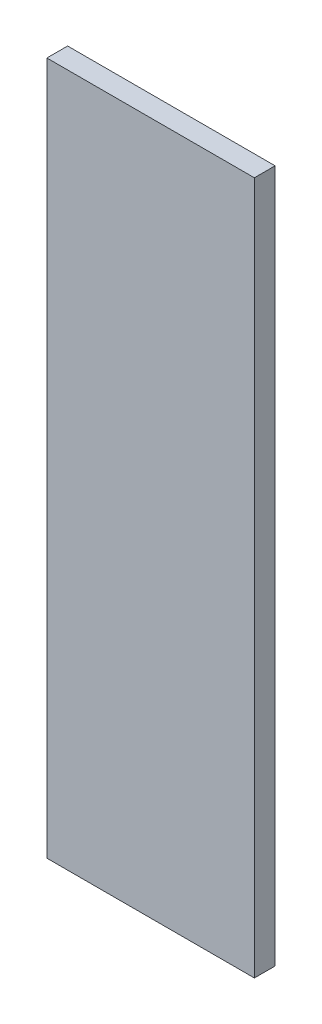
from build123d import *

# Parameters (mm, degrees)
ESQUISSE2_W        = 50
ESQUISSE2_H        = 167
BOSS_EXTRU_1_DEPTH = 5


with BuildPart() as part:
    # Esquisse2 → Boss.-Extru.1 (new body)
    with BuildSketch(Plane.XY):
        with Locations((25, 83.5)):
            Rectangle(ESQUISSE2_W, ESQUISSE2_H)
    extrude(amount=BOSS_EXTRU_1_DEPTH)


solid = part.part
